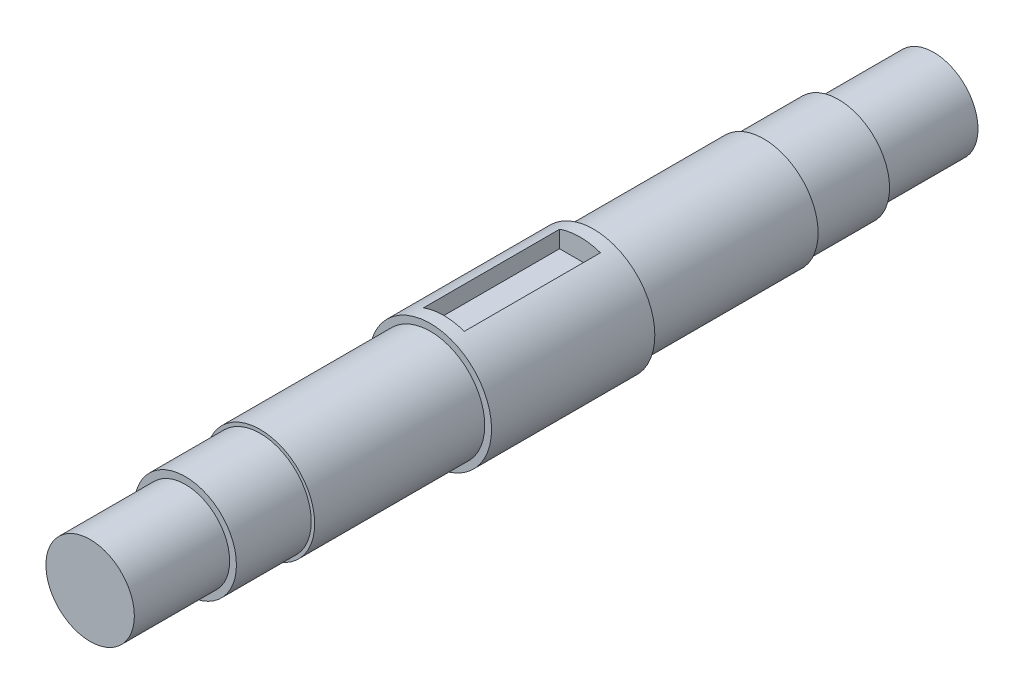
from build123d import *

# Parameters (mm, degrees)
SKETCH1_R           = 6.5
BOSS_EXTRUDE1_DEPTH = 14
SKETCH2_R           = 7.5
BOSS_EXTRUDE2_DEPTH = 11
SKETCH3_R           = 8
BOSS_EXTRUDE3_DEPTH = 25
SKETCH4_R           = 9
BOSS_EXTRUDE4_DEPTH = 12
SKETCH5_W           = 6
SKETCH5_H           = 20
CUT_EXTRUDE2_DEPTH  = 3


with BuildPart() as part:
    # Sketch1 → Boss-Extrude1 (new body)
    with BuildSketch(Plane(origin=(0, 0, 0), x_dir=(0, 1, 0), z_dir=(0, 0, 1))):
        with Locations(Location((0, 0, 0), (0, 0, 270))):
            Circle(SKETCH1_R)
    extrude(amount=BOSS_EXTRUDE1_DEPTH)

    # Sketch2 → Boss-Extrude2 (add)
    with BuildSketch(Plane.XY.offset(14)):
        Circle(SKETCH2_R)
    extrude(amount=BOSS_EXTRUDE2_DEPTH)

    # Sketch3 → Boss-Extrude3 (add)
    with BuildSketch(Plane.XY.offset(25)):
        Circle(SKETCH3_R)
    extrude(amount=BOSS_EXTRUDE3_DEPTH)

    # Sketch4 → Boss-Extrude4 (add)
    with BuildSketch(Plane.XY.offset(50)):
        Circle(SKETCH4_R)
    extrude(amount=BOSS_EXTRUDE4_DEPTH)

    # Mirror1: part across plane


with BuildPart() as part_1:
    add(part.part)
    add(part.part.mirror(Plane.XY.offset(62)))

    # Sketch5 → Cut-Extrude2 (cut)
    with BuildSketch(Plane(origin=(0, 9, 0), x_dir=(-1, 0, 0), z_dir=(0, 1, 0))):
        with Locations((0, 62)):
            Rectangle(SKETCH5_W, SKETCH5_H)
    extrude(amount=-CUT_EXTRUDE2_DEPTH, mode=Mode.SUBTRACT)


solid = part_1.part
